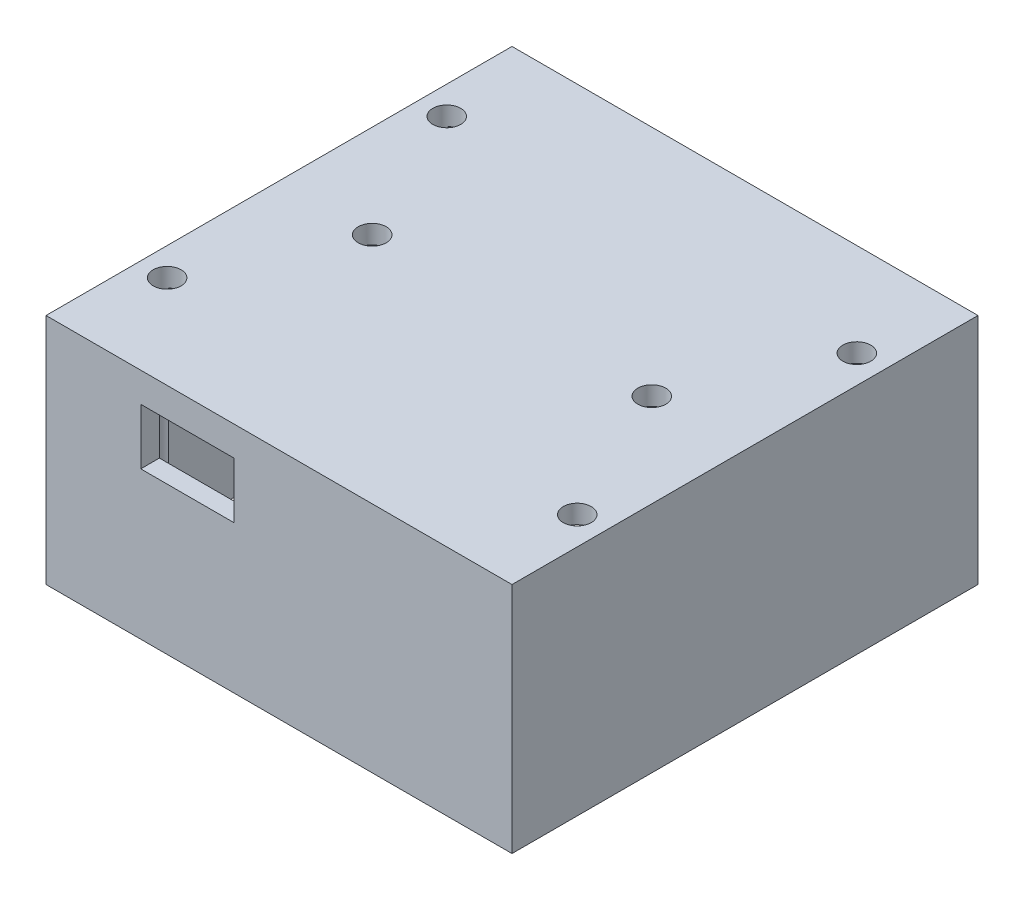
from build123d import *

# Parameters (mm, degrees)
SKETCH1_W           = 50
SKETCH1_H           = 50
BOSS_EXTRUDE1_DEPTH = 25
SHELL1_T            = -2
SKETCH3_W           = 10
SKETCH3_H           = 6
CUT_EXTRUDE1_DEPTH  = 12
SKETCH2_R           = 1.5
CUT_EXTRUDE2_DEPTH  = 44.301270189


with BuildPart() as part:
    # Sketch1 → Boss-Extrude1 (new body)
    with BuildSketch(Plane(origin=(0, 0, 0), x_dir=(1, 0, 0), z_dir=(0, 1, 0))):
        Rectangle(SKETCH1_W, SKETCH1_H)
    extrude(amount=BOSS_EXTRUDE1_DEPTH)

    # Shell1
    shell1_openings = [part.faces().sort_by_distance(p)[0] for p in [
        (0, 0, 0),
    ]]
    offset(amount=SHELL1_T, openings=shell1_openings, kind=Kind.INTERSECTION)

    # Sketch3 → Cut-Extrude1 (cut)
    with BuildSketch(Plane.XY.offset(25)):
        with Locations((-9.833582111, 18.831840126)):
            Rectangle(SKETCH3_W, SKETCH3_H)
    extrude(amount=-CUT_EXTRUDE1_DEPTH, mode=Mode.SUBTRACT)

    # Sketch2 → Cut-Extrude2 (cut, through all)
    with BuildSketch(Plane(origin=(0, 25, 0), x_dir=(1, 0, 0), z_dir=(0, 1, 0))):
        with Locations(Location((15, 0, 0), (0, 0, 270))):
            Circle(SKETCH2_R)
        with Locations(Location((-15, 0, 0), (0, 0, 270))):
            Circle(SKETCH2_R)
        with Locations(Location((-22, 15, 0), (0, 0, 270))):
            Circle(SKETCH2_R)
        with Locations(Location((22, 15, 0), (0, 0, 311.810314896))):
            Circle(SKETCH2_R)
        with Locations(Location((22, -15, 0), (0, 0, 270))):
            Circle(SKETCH2_R)
        with Locations(Location((-22, -15, 0), (0, 0, 228.189685104))):
            Circle(SKETCH2_R)
    extrude(amount=-CUT_EXTRUDE2_DEPTH, mode=Mode.SUBTRACT)


solid = part.part
